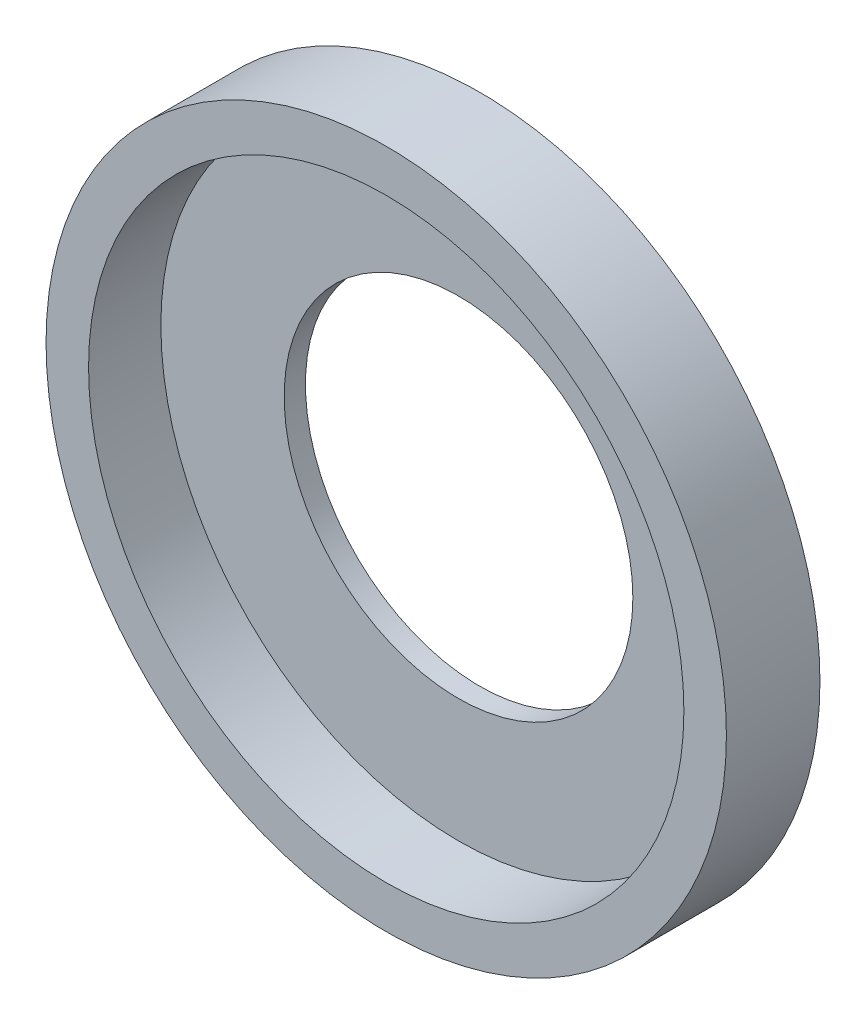
from build123d import *

# Parameters (mm, degrees)
OUTER_FLANGE_CONTACT_ANNULUS_ID8P2_START = -3.5
SKETCH1_R                                = 8
SKETCH1_R_2                              = 4.1
OUTER_FLANGE_CONTACT_ANNULUS_ID8P2_DEPTH = 0.5
M14X0P5_INTERNAL_THREAD_ENVELOPE_START   = -3
SKETCH2_R                                = 8
SKETCH2_R_2                              = 7
M14X0P5_INTERNAL_THREAD_ENVELOPE_DEPTH   = 1.7


with BuildPart() as part:
    # Sketch1 → Outer_Flange_Contact_Annulus_ID8p2 (new body)
    with BuildSketch(Plane.XY.offset(OUTER_FLANGE_CONTACT_ANNULUS_ID8P2_START)):
        Circle(SKETCH1_R)
        Circle(SKETCH1_R_2, mode=Mode.SUBTRACT)
    extrude(amount=OUTER_FLANGE_CONTACT_ANNULUS_ID8P2_DEPTH)

    # Sketch2 → M14x0p5_Internal_Thread_Envelope (add)
    with BuildSketch(Plane.XY.offset(M14X0P5_INTERNAL_THREAD_ENVELOPE_START)):
        Circle(SKETCH2_R)
        Circle(SKETCH2_R_2, mode=Mode.SUBTRACT)
    extrude(amount=M14X0P5_INTERNAL_THREAD_ENVELOPE_DEPTH)


solid = part.part
